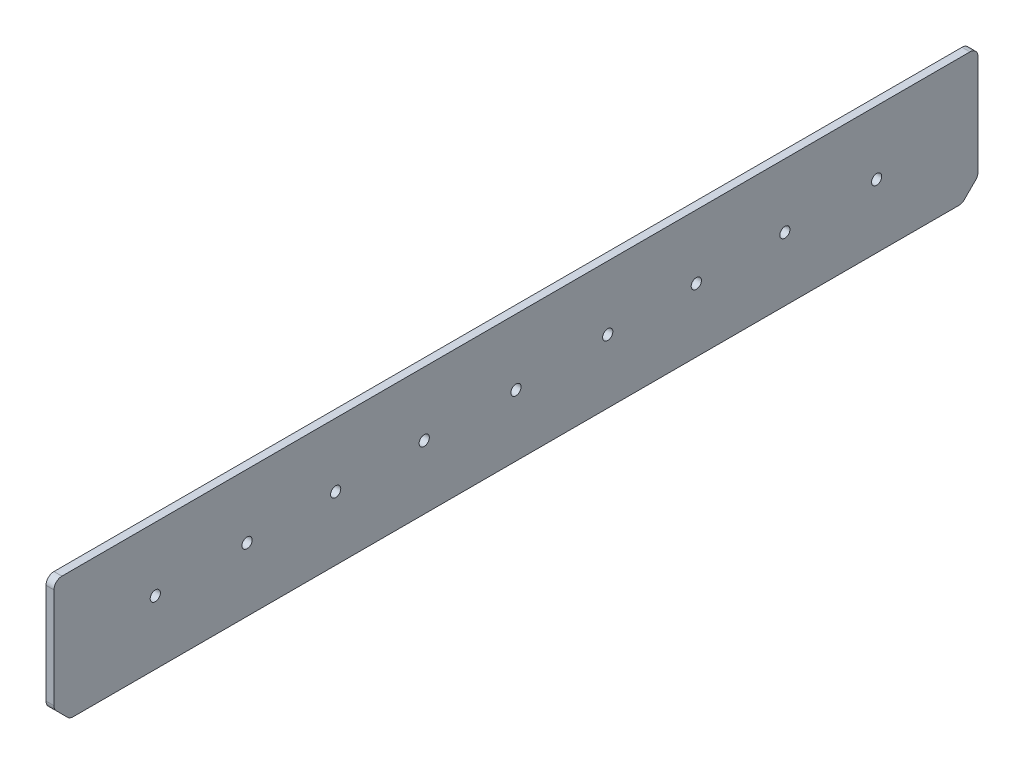
from build123d import *

# Parameters (mm, degrees)
SKETCH1_W           = 368.3
SKETCH1_H           = 50.8
BOSS_EXTRUDE1_DEPTH = 3.175
SKETCH2_R           = 2.032
CUT_EXTRUDE1_DEPTH  = 372.80049842
CHAMFER1_SIZE       = 6.35
FILLET1_R           = 3.175


with BuildPart() as part:
    # Sketch1 → Boss-Extrude1 (new body)
    with BuildSketch(Plane(origin=(0, 0, 0), x_dir=(0, 0, -1), z_dir=(1, 0, 0))):
        with Locations((184.15, 25.4)):
            Rectangle(SKETCH1_W, SKETCH1_H)
    extrude(amount=BOSS_EXTRUDE1_DEPTH)

    # Sketch2 → Cut-Extrude1 (cut, through all)
    with BuildSketch(Plane(origin=(3.175, 0, 0), x_dir=(0, 0, -1), z_dir=(1, 0, 0))):
        with Locations((327.905386247, 25.4)):
            Circle(SKETCH2_R)
        with Locations((291.329386247, 25.4)):
            Circle(SKETCH2_R)
        with Locations((256.023386247, 25.4)):
            Circle(SKETCH2_R)
        with Locations((220.717386247, 25.4)):
            Circle(SKETCH2_R)
        with Locations((184.15, 24.60625)):
            Circle(SKETCH2_R)
        with Locations((147.582613753, 25.4)):
            Circle(SKETCH2_R)
        with Locations((112.276613753, 25.4)):
            Circle(SKETCH2_R)
        with Locations((76.970613753, 25.4)):
            Circle(SKETCH2_R)
        with Locations((40.394613753, 25.4)):
            Circle(SKETCH2_R)
    extrude(amount=-CUT_EXTRUDE1_DEPTH, mode=Mode.SUBTRACT)

    # Chamfer1
    chamfer1_edges = [part.edges().sort_by_distance(p)[0] for p in [
        (1.5875, 0, -368.3),
        (1.5875, 0, 0),
    ]]
    chamfer(chamfer1_edges, length=CHAMFER1_SIZE)

    # Fillet1
    fillet1_edges = [part.edges().sort_by_distance(p)[0] for p in [
        (1.5875, 0, -361.95),
        (1.5875, 0, -6.35),
        (1.5875, 6.35, 0),
        (1.5875, 6.35, -368.3),
        (1.5875, 50.8, 0),
        (1.5875, 50.8, -368.3),
    ]]
    fillet(fillet1_edges, radius=FILLET1_R)


solid = part.part
